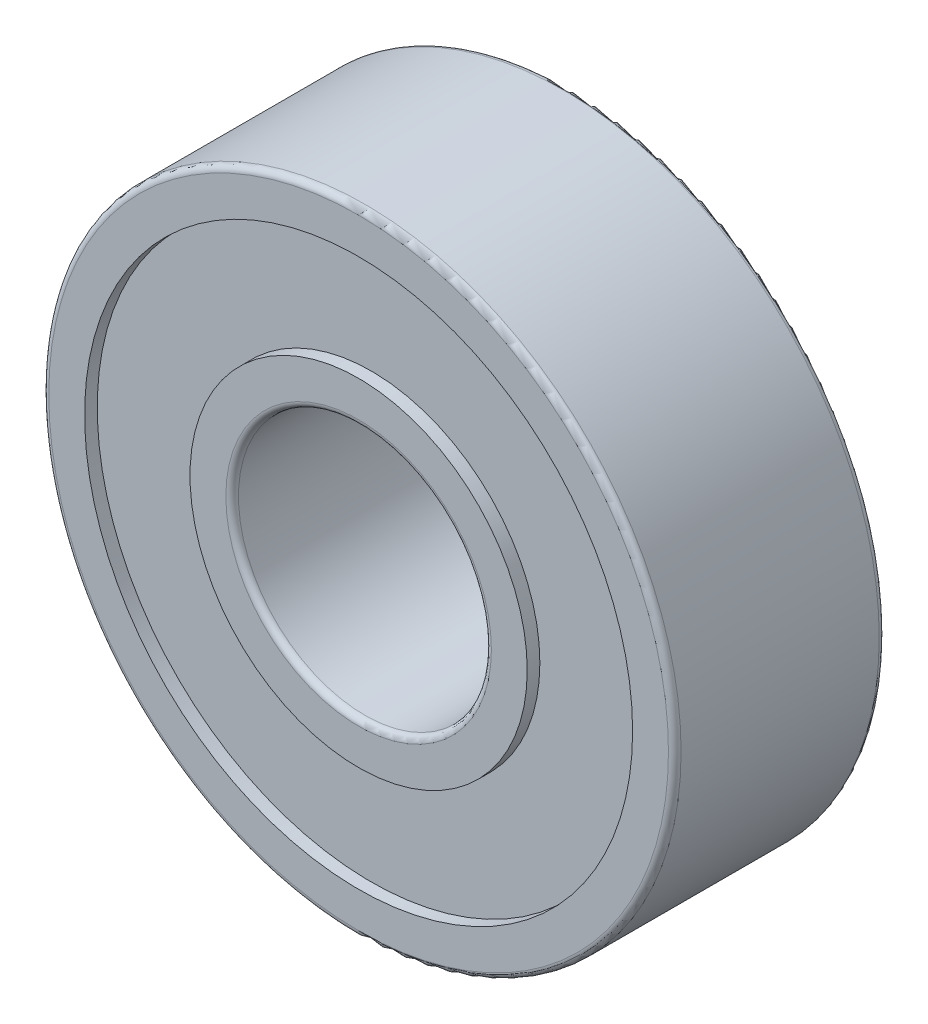
from build123d import *

# Parameters (mm, degrees)
SKETCH1_R           = 7.5
SKETCH1_R_2         = 3
BOSS_EXTRUDE1_DEPTH = 5
SKETCH2_R           = 6.5
SKETCH2_R_2         = 4
CUT_EXTRUDE1_DEPTH  = 0.3
CUT_EXTRUDE2_START  = -4.5
SKETCH2_2_R         = 6.5
SKETCH2_2_R_2       = 4
CUT_EXTRUDE2_DEPTH  = 0.5
FILLET1_R           = 0.15


with BuildPart() as part:
    # Sketch1 → Boss-Extrude1 (new body)
    with BuildSketch(Plane.XY):
        Circle(SKETCH1_R)
        Circle(SKETCH1_R_2, mode=Mode.SUBTRACT)
    extrude(amount=BOSS_EXTRUDE1_DEPTH)

    # Sketch2 → Cut-Extrude1 (cut)
    with BuildSketch(Plane.XY.offset(5)):
        Circle(SKETCH2_R)
        Circle(SKETCH2_R_2, mode=Mode.SUBTRACT)
    extrude(amount=-CUT_EXTRUDE1_DEPTH, mode=Mode.SUBTRACT)

    # Sketch2<2> → Cut-Extrude2 (cut)
    with BuildSketch(Plane.XY.offset(5).offset(CUT_EXTRUDE2_START)):
        Circle(SKETCH2_2_R)
        Circle(SKETCH2_2_R_2, mode=Mode.SUBTRACT)
    extrude(amount=-CUT_EXTRUDE2_DEPTH, mode=Mode.SUBTRACT)

    # Fillet1
    fillet1_edges = [part.edges().sort_by_distance(p)[0] for p in [
        (-7.5, 0, 0),
        (-7.5, 0, 5),
        (-3, 0, 0),
        (-3, 0, 5),
    ]]
    fillet(fillet1_edges, radius=FILLET1_R)


solid = part.part
